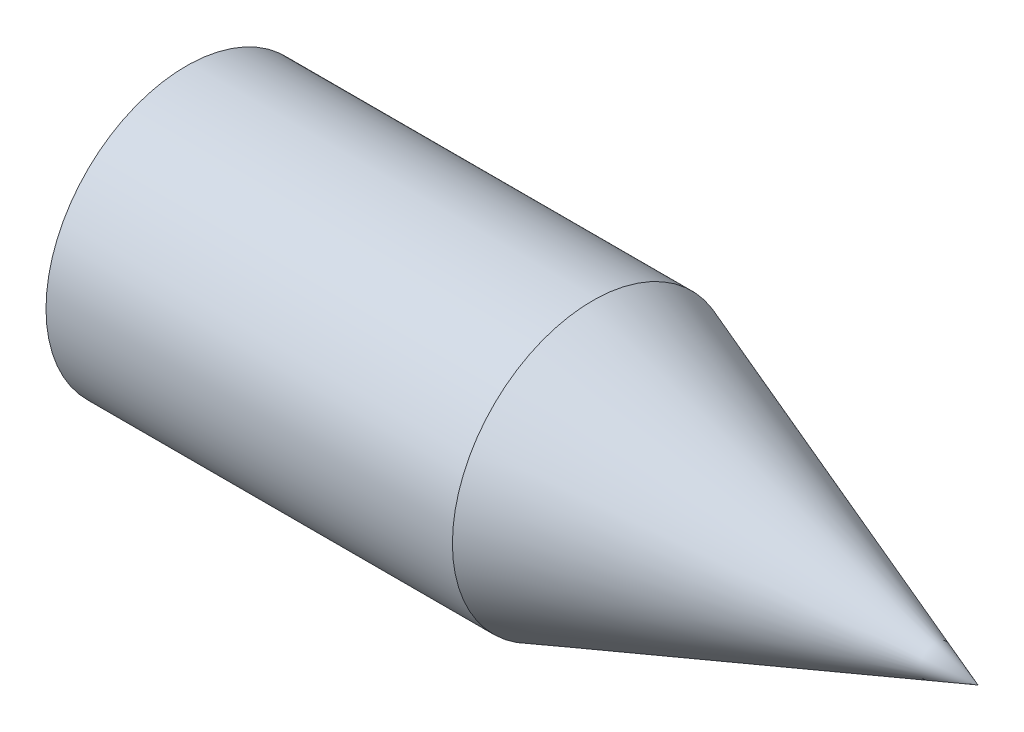
from build123d import *


with BuildPart() as part:
    # Skizze1 → Rotation1 (revolve)
    with BuildSketch(Plane.XY, mode=Mode.PRIVATE) as rotation1_sk:
        Polygon((0, 5), (0, 6.2), (17.965639999, 6.2), (35, 0), (16, 0), (16, 5), align=None)
    revolve(rotation1_sk.sketch.rotate(Axis((0, 0, 0), (1, 0, 0)), 90), axis=Axis((0, 0, 0), (1, 0, 0)))


solid = part.part
